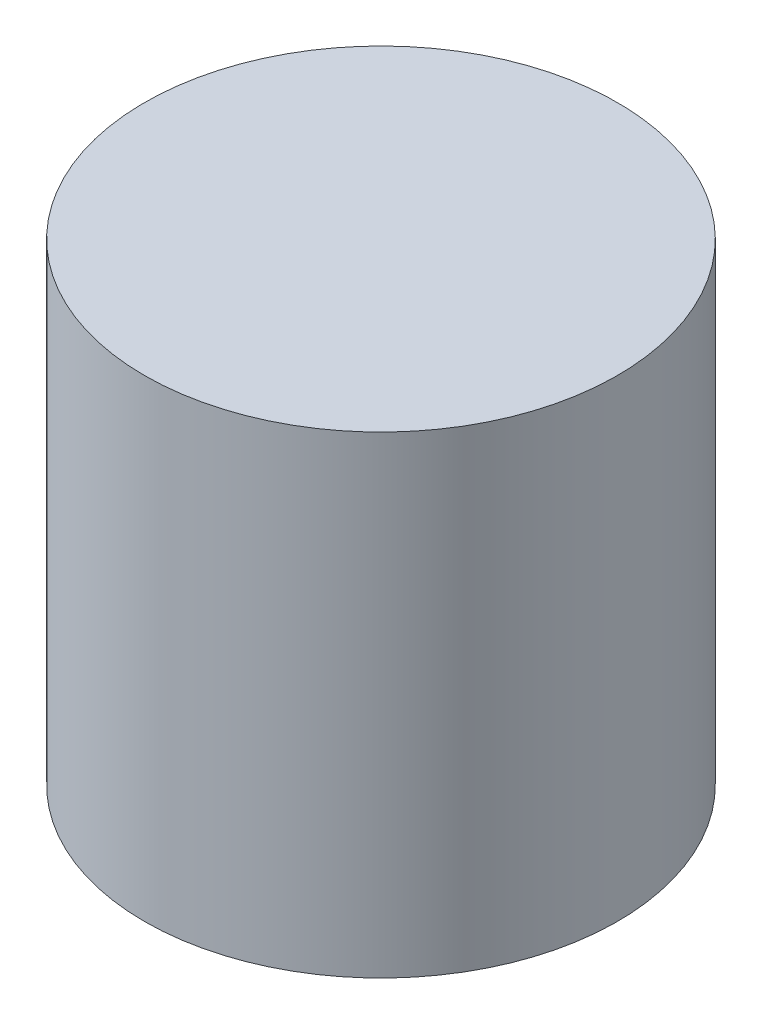
from build123d import *

# Parameters (mm, degrees)
SKETCH1_R           = 3.5
BOSS_EXTRUDE1_DEPTH = 7


with BuildPart() as part:
    # Sketch1 → Boss-Extrude1 (new body)
    with BuildSketch(Plane(origin=(0, 0, 0), x_dir=(1, 0, 0), z_dir=(0, 1, 0))):
        with Locations(Location((0, 0, 0), (0, 0, 270))):
            Circle(SKETCH1_R)
    extrude(amount=BOSS_EXTRUDE1_DEPTH)


solid = part.part
